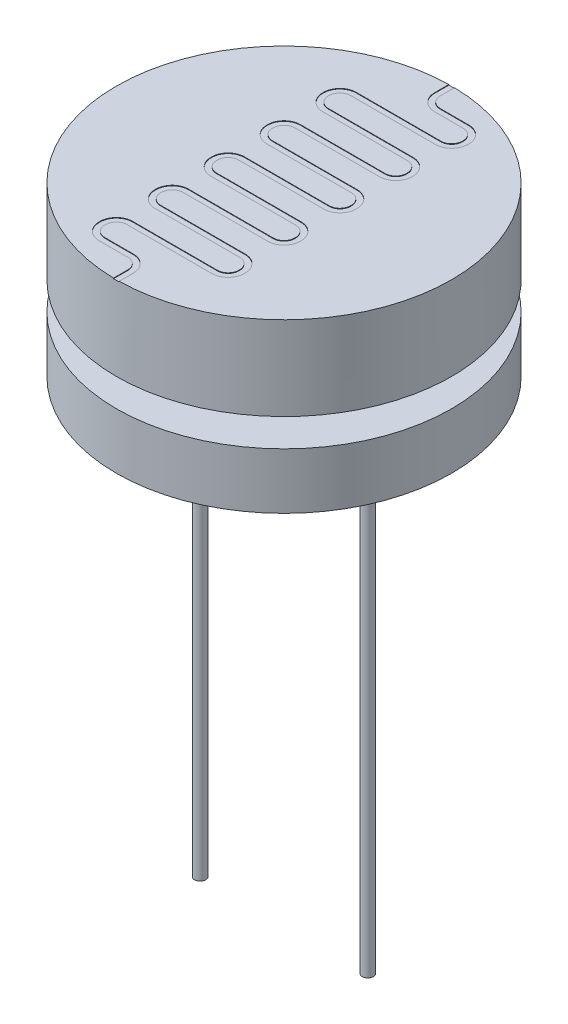
from build123d import *

# Parameters (mm, degrees)
SKETCH1_R               = 3
BOSS_EXTRUDE1_DEPTH     = 3
CUT_EXTRUDE1_DEPTH      = 6.196152423
CUT_EXTRUDE1_DEPTH_BACK = 6.196152423
SKETCH2_W               = 6
SKETCH2_H               = 0.5
SKETCH3_R               = 0.1
BOSS_EXTRUDE2_DEPTH     = 10
CUT_EXTRUDE4_DEPTH      = 0.01
SCALE1_SCALE            = 0.5


with BuildPart() as part:
    # Sketch1 → Boss-Extrude1 (new body)
    with BuildSketch(Plane(origin=(0, 0, 0), x_dir=(1, 0, 0), z_dir=(0, 1, 0))):
        with Locations(Location((0, 0, 0), (0, 0, 270))):
            Circle(SKETCH1_R)
    extrude(amount=BOSS_EXTRUDE1_DEPTH)

    # Sketch2 → Cut-Extrude1 (cut, two sides: drawn at the far end of the back side and taken through both)
    with BuildSketch(Plane(origin=(0, 0, 0), x_dir=(0, 0, -1), z_dir=(1, 0, 0)).offset(-CUT_EXTRUDE1_DEPTH_BACK)):
        with Locations((0, 1.25)):
            Rectangle(SKETCH2_W, SKETCH2_H)
    extrude(amount=CUT_EXTRUDE1_DEPTH + CUT_EXTRUDE1_DEPTH_BACK, mode=Mode.SUBTRACT)


with BuildPart() as cut_extrude1_piece_1:
    # of the separate pieces the step leaves, piece 1, a body of its own (cut_extrude1_pieces)
    add(part.part.solids().sort_by_distance((0, 1.5, 3))[0])



with BuildPart() as cut_extrude1_piece_2:
    # of the separate pieces the step leaves, piece 2, a body of its own (cut_extrude1_pieces)
    add(part.part.solids().sort_by_distance((0, 0, 3))[0])


with BuildPart() as cut_extrude1_piece_1_1:
    add(cut_extrude1_piece_1.part)

    add(cut_extrude1_piece_2.part)  # Boss-Extrude2 merges Cut-Extrude1 piece 2
    # Sketch3 → Boss-Extrude2 (add)
    with BuildSketch(Plane.XZ.offset(-1.5)):
        with Locations(Location((-1.5, 0, 0), (0, 0, 90))):
            Circle(SKETCH3_R)
        with Locations(Location((1.5, 0, 0), (0, 0, 90))):
            Circle(SKETCH3_R)
    extrude(amount=BOSS_EXTRUDE2_DEPTH)

    # Sketch4 → Cut-Extrude4 (cut)
    with BuildSketch(Plane(origin=(0, 3, 0), x_dir=(1, 0, 0), z_dir=(0, 1, 0))):
        with BuildLine():
            Line((0.05, -2.743253312), (0.05, -3))
            ThreePointArc((0.05, -3), (0, -3.000416638), (-0.05, -3))
            Line((-0.05, -3), (-0.05, -2.743253312))
            ThreePointArc((-0.05, -2.743253312), (-0.106602585, -2.606602585), (-0.243253312, -2.55))
            Line((-0.243253312, -2.55), (-0.756746688, -2.55))
            ThreePointArc((-0.756746688, -2.55), (-0.964108093, -2.464108093), (-1.05, -2.256746688))
            Line((-1.05, -2.256746688), (-1.05, -2.243253312))
            ThreePointArc((-1.05, -2.243253312), (-0.964108093, -2.035891907), (-0.756746688, -1.95))
            Line((-0.756746688, -1.95), (0.756746688, -1.95))
            ThreePointArc((0.756746688, -1.95), (0.893397415, -1.893397415), (0.95, -1.756746688))
            Line((0.95, -1.756746688), (0.95, -1.743253312))
            ThreePointArc((0.95, -1.743253312), (0.893397415, -1.606602585), (0.756746688, -1.55))
            Line((0.756746688, -1.55), (-0.756746688, -1.55))
            ThreePointArc((-0.756746688, -1.55), (-0.964108093, -1.464108093), (-1.05, -1.256746688))
            Line((-1.05, -1.256746688), (-1.05, -1.243253312))
            ThreePointArc((-1.05, -1.243253312), (-0.964108093, -1.035891907), (-0.756746688, -0.95))
            Line((-0.756746688, -0.95), (0.756746688, -0.95))
            ThreePointArc((0.756746688, -0.95), (0.893397415, -0.893397415), (0.95, -0.756746688))
            Line((0.95, -0.756746688), (0.95, -0.743253312))
            ThreePointArc((0.95, -0.743253312), (0.893397415, -0.606602585), (0.756746688, -0.55))
            Line((0.756746688, -0.55), (-0.756746688, -0.55))
            ThreePointArc((-0.756746688, -0.55), (-0.964108093, -0.464108093), (-1.05, -0.256746688))
            Line((-1.05, -0.256746688), (-1.05, -0.243253312))
            ThreePointArc((-1.05, -0.243253312), (-0.964108093, -0.035891907), (-0.756746688, 0.05))
            Line((-0.756746688, 0.05), (0.756746688, 0.05))
            ThreePointArc((0.756746688, 0.05), (0.893397415, 0.106602585), (0.95, 0.243253312))
            Line((0.95, 0.243253312), (0.95, 0.256746688))
            ThreePointArc((0.95, 0.256746688), (0.893397415, 0.393397415), (0.756746688, 0.45))
            Line((0.756746688, 0.45), (-0.756746688, 0.45))
            ThreePointArc((-0.756746688, 0.45), (-0.964108093, 0.535891907), (-1.05, 0.743253312))
            Line((-1.05, 0.743253312), (-1.05, 0.756746688))
            ThreePointArc((-1.05, 0.756746688), (-0.964108093, 0.964108093), (-0.756746688, 1.05))
            Line((-0.756746688, 1.05), (0.756746688, 1.05))
            ThreePointArc((0.756746688, 1.05), (0.893397415, 1.106602585), (0.95, 1.243253312))
            Line((0.95, 1.243253312), (0.95, 1.256746688))
            ThreePointArc((0.95, 1.256746688), (0.893397415, 1.393397415), (0.756746688, 1.45))
            Line((0.756746688, 1.45), (-0.756746688, 1.45))
            ThreePointArc((-0.756746688, 1.45), (-0.964108093, 1.535891907), (-1.05, 1.743253312))
            Line((-1.05, 1.743253312), (-1.05, 1.756746688))
            ThreePointArc((-1.05, 1.756746688), (-0.964108093, 1.964108093), (-0.756746688, 2.05))
            Line((-0.756746688, 2.05), (0.756746688, 2.05))
            ThreePointArc((0.756746688, 2.05), (0.893397415, 2.106602585), (0.95, 2.243253312))
            Line((0.95, 2.243253312), (0.95, 2.256746688))
            ThreePointArc((0.95, 2.256746688), (0.893397415, 2.393397415), (0.756746688, 2.45))
            Line((0.756746688, 2.45), (0.243253312, 2.45))
            ThreePointArc((0.243253312, 2.45), (0.035891907, 2.535891907), (-0.05, 2.743253312))
            Line((-0.05, 2.743253312), (-0.05, 3))
            ThreePointArc((-0.05, 3), (0, 3.000416638), (0.05, 3))
            Line((0.05, 3), (0.05, 2.743253312))
            ThreePointArc((0.05, 2.743253312), (0.106602585, 2.606602585), (0.243253312, 2.55))
            Line((0.243253312, 2.55), (0.756746688, 2.55))
            ThreePointArc((0.756746688, 2.55), (0.964108093, 2.464108093), (1.05, 2.256746688))
            Line((1.05, 2.256746688), (1.05, 2.243253312))
            ThreePointArc((1.05, 2.243253312), (0.964108093, 2.035891907), (0.756746688, 1.95))
            Line((0.756746688, 1.95), (-0.756746688, 1.95))
            ThreePointArc((-0.756746688, 1.95), (-0.893397415, 1.893397415), (-0.95, 1.756746688))
            Line((-0.95, 1.756746688), (-0.95, 1.743253312))
            ThreePointArc((-0.95, 1.743253312), (-0.893397415, 1.606602585), (-0.756746688, 1.55))
            Line((-0.756746688, 1.55), (0.756746688, 1.55))
            ThreePointArc((0.756746688, 1.55), (0.964108093, 1.464108093), (1.05, 1.256746688))
            Line((1.05, 1.256746688), (1.05, 1.243253312))
            ThreePointArc((1.05, 1.243253312), (0.964108093, 1.035891907), (0.756746688, 0.95))
            Line((0.756746688, 0.95), (-0.756746688, 0.95))
            ThreePointArc((-0.756746688, 0.95), (-0.893397415, 0.893397415), (-0.95, 0.756746688))
            Line((-0.95, 0.756746688), (-0.95, 0.743253312))
            ThreePointArc((-0.95, 0.743253312), (-0.893397415, 0.606602585), (-0.756746688, 0.55))
            Line((-0.756746688, 0.55), (0.756746688, 0.55))
            ThreePointArc((0.756746688, 0.55), (0.964108093, 0.464108093), (1.05, 0.256746688))
            Line((1.05, 0.256746688), (1.05, 0.243253312))
            ThreePointArc((1.05, 0.243253312), (0.964108093, 0.035891907), (0.756746688, -0.05))
            Line((0.756746688, -0.05), (-0.756746688, -0.05))
            ThreePointArc((-0.756746688, -0.05), (-0.893397415, -0.106602585), (-0.95, -0.243253312))
            Line((-0.95, -0.243253312), (-0.95, -0.256746688))
            ThreePointArc((-0.95, -0.256746688), (-0.893397415, -0.393397415), (-0.756746688, -0.45))
            Line((-0.756746688, -0.45), (0.756746688, -0.45))
            ThreePointArc((0.756746688, -0.45), (0.964108093, -0.535891907), (1.05, -0.743253312))
            Line((1.05, -0.743253312), (1.05, -0.756746688))
            ThreePointArc((1.05, -0.756746688), (0.964108093, -0.964108093), (0.756746688, -1.05))
            Line((0.756746688, -1.05), (-0.756746688, -1.05))
            ThreePointArc((-0.756746688, -1.05), (-0.893397415, -1.106602585), (-0.95, -1.243253312))
            Line((-0.95, -1.243253312), (-0.95, -1.256746688))
            ThreePointArc((-0.95, -1.256746688), (-0.893397415, -1.393397415), (-0.756746688, -1.45))
            Line((-0.756746688, -1.45), (0.756746688, -1.45))
            ThreePointArc((0.756746688, -1.45), (0.964108093, -1.535891907), (1.05, -1.743253312))
            Line((1.05, -1.743253312), (1.05, -1.756746688))
            ThreePointArc((1.05, -1.756746688), (0.964108093, -1.964108093), (0.756746688, -2.05))
            Line((0.756746688, -2.05), (-0.756746688, -2.05))
            ThreePointArc((-0.756746688, -2.05), (-0.893397415, -2.106602585), (-0.95, -2.243253312))
            Line((-0.95, -2.243253312), (-0.95, -2.256746688))
            ThreePointArc((-0.95, -2.256746688), (-0.893397415, -2.393397415), (-0.756746688, -2.45))
            Line((-0.756746688, -2.45), (-0.243253312, -2.45))
            ThreePointArc((-0.243253312, -2.45), (-0.035891907, -2.535891907), (0.05, -2.743253312))
        make_face()
    extrude(amount=-CUT_EXTRUDE4_DEPTH, mode=Mode.SUBTRACT)


with BuildPart() as cut_extrude1_piece_1_2:
    # Scale1: scaled about (0, 0, 0)
    add(cut_extrude1_piece_1_1.part.scale(SCALE1_SCALE))


solid = cut_extrude1_piece_1_2.part
